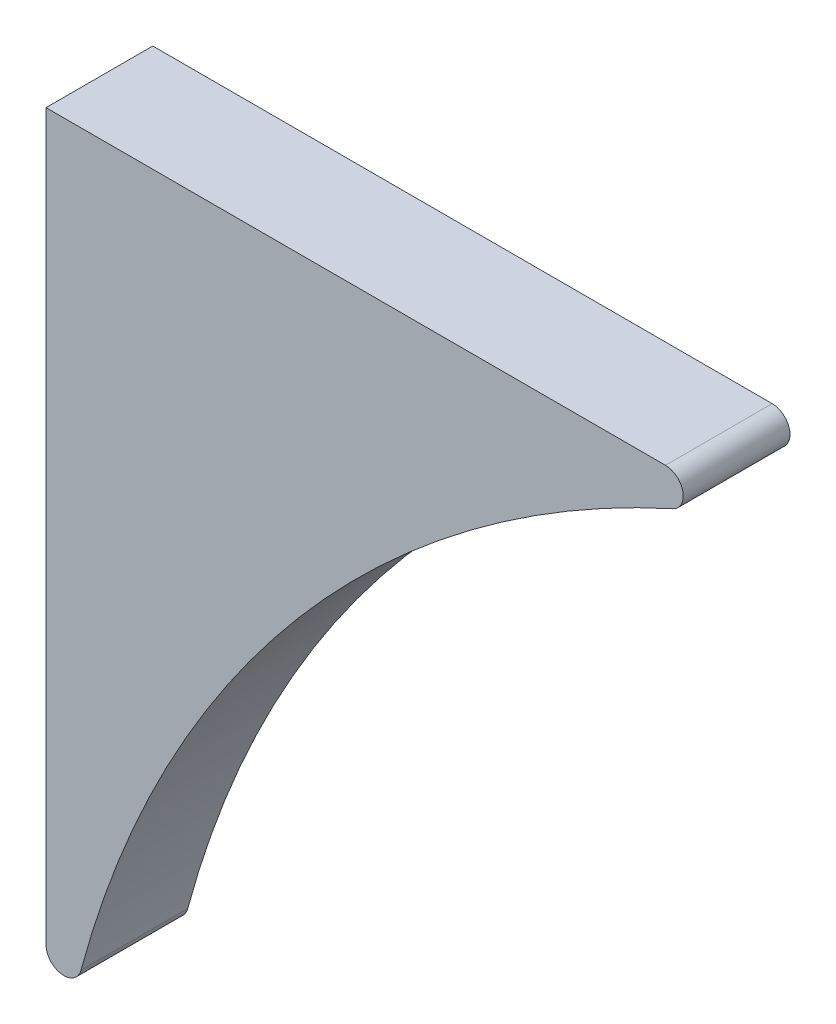
from build123d import *

# Parameters (mm, degrees)
BOSS_EXTRUDE1_DEPTH     = 3
CUT_EXTRUDE1_DEPTH      = 73.173402303
CUT_EXTRUDE1_DEPTH_BACK = 73.173402303
FILLET1_R               = 1


with BuildPart() as part:
    # Sketch1 → Boss-Extrude1 (new, symmetric)
    with BuildSketch(Plane.XY):
        Polygon((0, 0), (0, -60), (40, 0), align=None)
    extrude(amount=BOSS_EXTRUDE1_DEPTH, both=True)

    # Sketch2 → Cut-Extrude1 (cut, two sides: drawn at the far end of the back side and taken through both)
    with BuildSketch(Plane.XY.offset(-CUT_EXTRUDE1_DEPTH_BACK)):
        with BuildLine():
            Line((40, 0), (0, -60))
            ThreePointArc((0, -60), (9.980712645, -23.320475097), (40, 0))
        make_face()
    extrude(amount=CUT_EXTRUDE1_DEPTH + CUT_EXTRUDE1_DEPTH_BACK, mode=Mode.SUBTRACT)

    # Fillet1
    fillet1_edges = [part.edges().sort_by_distance(p)[0] for p in [
        (0, -53.204973741, 0),
        (40, 0, 0),
    ]]
    fillet(fillet1_edges, radius=FILLET1_R)


solid = part.part
